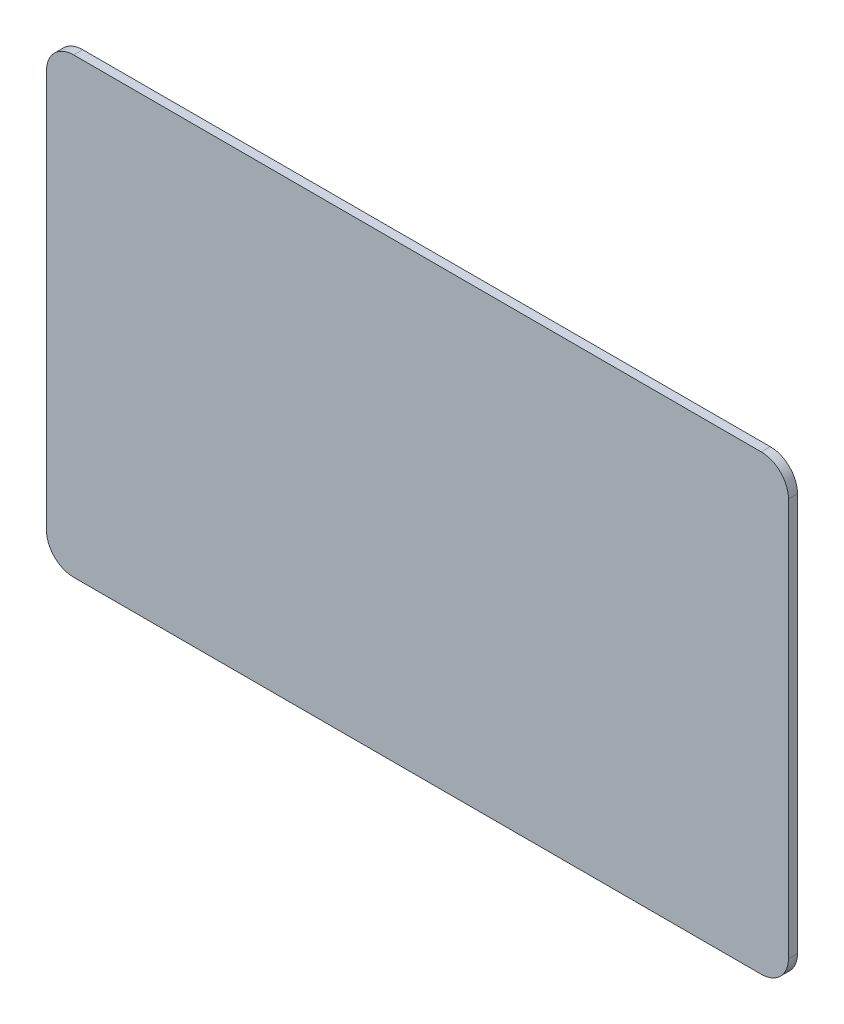
from build123d import *

# Parameters (mm, degrees)
SKETCH_1_W      = 82
SKETCH_1_H      = 50
EXTRUDE_1_DEPTH = 1
FILLET_1_R      = 3


with BuildPart() as part:
    # 草图1 → 凸台-拉伸1 (new body)
    with BuildSketch(Plane.XY):
        Rectangle(SKETCH_1_W, SKETCH_1_H)
    extrude(amount=EXTRUDE_1_DEPTH)

    # 圆角1
    fillet_1_edges = [part.edges().sort_by_distance(p)[0] for p in [
        (41, -25, 0.5),
        (-41, -25, 0.5),
        (-41, 25, 0.5),
        (41, 25, 0.5),
    ]]
    fillet(fillet_1_edges, radius=FILLET_1_R)


solid = part.part
